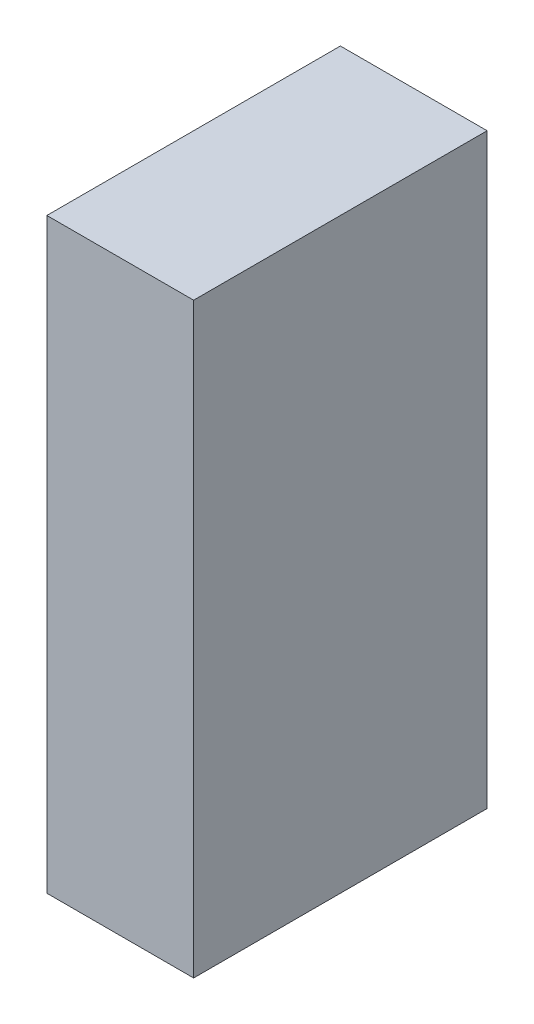
from build123d import *

# Parameters (mm, degrees)
RECTANGLESKETCH_W = 20
RECTANGLESKETCH_H = 40
BLINDBOSS_DEPTH   = 10


with BuildPart() as part:
    # RectangleSketch → BlindBoss (new body)
    with BuildSketch(Plane(origin=(0, 0, 0), x_dir=(0, 0, -1), z_dir=(1, 0, 0))):
        with Locations((-10, 20)):
            Rectangle(RECTANGLESKETCH_W, RECTANGLESKETCH_H)
    extrude(amount=BLINDBOSS_DEPTH)


solid = part.part
